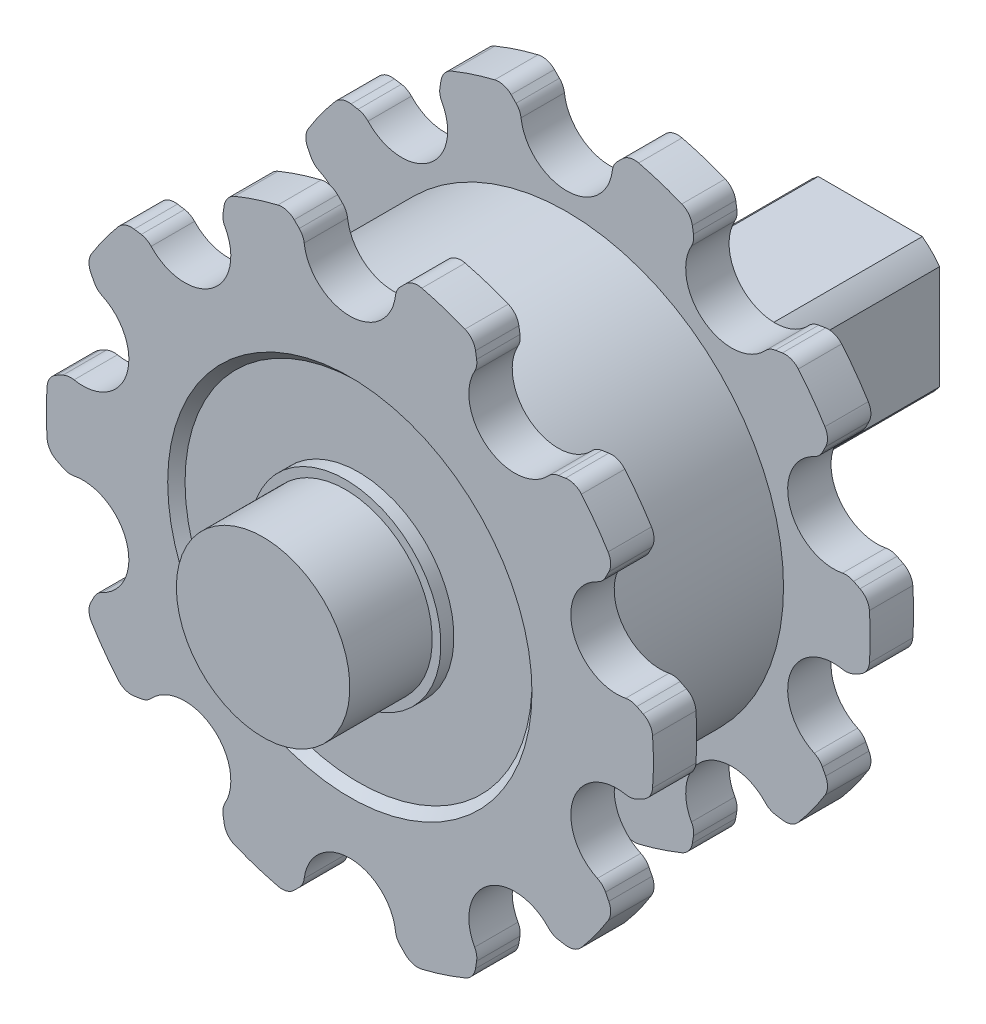
from build123d import *

# Parameters (mm, degrees)
TAGLIO_ESTRUSIONE1_DEPTH = 20
TAGLIO_ESTRUSIONE2_DEPTH = 43


with BuildPart() as part:
    # Schizzo1 → Rivoluzione1 (revolve)
    with BuildSketch(Plane(origin=(0, 0, 0), x_dir=(1, 0, 0), z_dir=(0, 1, 0)), mode=Mode.PRIVATE) as rivoluzione1_sk:
        Polygon((0, 0), (10, 0), (10, 9.5), (11, 9.5), (11, 11), (20, 11), (21, 10), (35, 10), (35, 15), (25, 15), (25, 35), (35, 35), (35, 40), (21, 40), (20, 39), (11, 39), (11, 40.5), (10, 40.5), (10, 70), (0, 70), align=None)
    revolve(rivoluzione1_sk.sketch.rotate(Axis((0, 0, -70), (0, 0, 1)), 180), axis=Axis((0, 0, -70), (0, 0, 1)))

    # Schizzo2 → Taglio-Estrusione1 (cut)
    with BuildSketch(Plane(origin=(0, 0, -70), x_dir=(-1, 0, 0), z_dir=(0, 0, -1))):
        with BuildLine():
            Line((-8, -6), (-8, 6))
            ThreePointArc((-8, 6), (-10, 0), (-8, -6))
        make_face()
        with BuildLine():
            Line((8, -6), (8, 6))
            ThreePointArc((8, 6), (10, 0), (8, -6))
        make_face()
        with BuildLine():
            Line((-6, 8), (6, 8))
            ThreePointArc((6, 8), (0, 10), (-6, 8))
        make_face()
        with BuildLine():
            Line((-6, -8), (6, -8))
            ThreePointArc((6, -8), (0, -10), (-6, -8))
        make_face()
    extrude(amount=-TAGLIO_ESTRUSIONE1_DEPTH, mode=Mode.SUBTRACT)

    # Schizzo3 → Taglio-Estrusione2 (cut)
    with BuildSketch(Plane(origin=(0, 0, -40), x_dir=(-1, 0, 0), z_dir=(0, 0, -1))):
        with BuildLine():
            Line((-5.832321184, 32.893001184), (-6.412064071, 33.472744071))
            ThreePointArc((-6.412064071, 33.472744071), (-7.287076109, 33.984474879), (-8.30059749, 34.001471752))
            ThreePointArc((-8.30059749, 34.001471752), (0, 35), (8.30059749, 34.001471752))
            ThreePointArc((8.30059749, 34.001471752), (7.287076109, 33.984474879), (6.412064071, 33.472744071))
            Line((6.412064071, 33.472744071), (5.832321184, 32.893001184))
            ThreePointArc((5.832321184, 32.893001184), (5.448477821, 32.354568013), (5.261182761, 31.720401972))
            ThreePointArc((5.261182761, 31.720401972), (0, 27.06068), (-5.261182761, 31.720401972))
            ThreePointArc((-5.261182761, 31.720401972), (-5.448477821, 32.354568013), (-5.832321184, 32.893001184))
        make_face()
        with BuildLine():
            Line((14.615574045, 30.039149333), (14.487316516, 30.8489355))
            ThreePointArc((14.487316516, 30.8489355), (14.080204729, 31.777253591), (13.270239219, 32.386737271))
            ThreePointArc((13.270239219, 32.386737271), (20.57248383, 28.315594803), (26.700888085, 22.628799691))
            ThreePointArc((26.700888085, 22.628799691), (25.870941552, 23.210781853), (24.862254122, 23.311102104))
            Line((24.862254122, 23.311102104), (24.052467954, 23.182844575))
            ThreePointArc((24.052467954, 23.182844575), (23.425449073, 22.972860457), (22.90117074, 22.569898627))
            ThreePointArc((22.90117074, 22.569898627), (15.905868621, 21.892549999), (14.388398212, 28.7547899))
            ThreePointArc((14.388398212, 28.7547899), (14.609626771, 29.377930279), (14.615574045, 30.039149333))
        make_face()
        with BuildLine():
            Line((29.480816754, 15.711363429), (29.8530346, 16.441882084))
            ThreePointArc((29.8530346, 16.441882084), (30.069325929, 17.4322015), (29.772295585, 18.401369937))
            ThreePointArc((29.772295585, 18.401369937), (33.28697807, 10.815594803), (34.902346961, 2.612695273))
            ThreePointArc((34.902346961, 2.612695273), (34.572986643, 3.571359064), (33.815908134, 4.245411448))
            Line((33.815908134, 4.245411448), (33.085389479, 4.617629295))
            ThreePointArc((33.085389479, 4.617629295), (32.454694981, 4.816301026), (31.793689879, 4.798461129))
            ThreePointArc((31.793689879, 4.798461129), (25.736236049, 8.362209999), (28.542100111, 14.805825426))
            ThreePointArc((28.542100111, 14.805825426), (29.0873505, 15.179921698), (29.480816754, 15.711363429))
        make_face()
        with BuildLine():
            Line((33.085389479, -4.617629295), (33.815908134, -4.245411448))
            ThreePointArc((33.815908134, -4.245411448), (34.572986643, -3.571359064), (34.902346961, -2.612695273))
            ThreePointArc((34.902346961, -2.612695273), (33.28697807, -10.815594803), (29.772295585, -18.401369937))
            ThreePointArc((29.772295585, -18.401369937), (30.069325929, -17.4322015), (29.8530346, -16.441882084))
            Line((29.8530346, -16.441882084), (29.480816754, -15.711363429))
            ThreePointArc((29.480816754, -15.711363429), (29.0873505, -15.179921698), (28.542100111, -14.805825426))
            ThreePointArc((28.542100111, -14.805825426), (25.736236049, -8.362209999), (31.793689879, -4.798461129))
            ThreePointArc((31.793689879, -4.798461129), (32.454694981, -4.816301026), (33.085389479, -4.617629295))
        make_face()
        with BuildLine():
            Line((24.052467954, -23.182844575), (24.862254122, -23.311102104))
            ThreePointArc((24.862254122, -23.311102104), (25.870941552, -23.210781853), (26.700888085, -22.628799691))
            ThreePointArc((26.700888085, -22.628799691), (20.57248383, -28.315594803), (13.270239219, -32.386737271))
            ThreePointArc((13.270239219, -32.386737271), (14.080204729, -31.777253591), (14.487316516, -30.8489355))
            Line((14.487316516, -30.8489355), (14.615574045, -30.039149333))
            ThreePointArc((14.615574045, -30.039149333), (14.609626771, -29.377930279), (14.388398212, -28.7547899))
            ThreePointArc((14.388398212, -28.7547899), (15.905868621, -21.892549999), (22.90117074, -22.569898627))
            ThreePointArc((22.90117074, -22.569898627), (23.425449073, -22.972860457), (24.052467954, -23.182844575))
        make_face()
        with BuildLine():
            Line((5.832321184, -32.893001184), (6.412064071, -33.472744071))
            ThreePointArc((6.412064071, -33.472744071), (7.287076109, -33.984474879), (8.30059749, -34.001471752))
            ThreePointArc((8.30059749, -34.001471752), (0, -35), (-8.30059749, -34.001471752))
            ThreePointArc((-8.30059749, -34.001471752), (-7.287076109, -33.984474879), (-6.412064071, -33.472744071))
            Line((-6.412064071, -33.472744071), (-5.832321184, -32.893001184))
            ThreePointArc((-5.832321184, -32.893001184), (-5.448477821, -32.354568013), (-5.261182761, -31.720401972))
            ThreePointArc((-5.261182761, -31.720401972), (0, -27.06068), (5.261182761, -31.720401972))
            ThreePointArc((5.261182761, -31.720401972), (5.448477821, -32.354568013), (5.832321184, -32.893001184))
        make_face()
        with BuildLine():
            Line((-14.615574045, -30.039149333), (-14.487316516, -30.8489355))
            ThreePointArc((-14.487316516, -30.8489355), (-14.080204729, -31.777253591), (-13.270239219, -32.386737271))
            ThreePointArc((-13.270239219, -32.386737271), (-20.57248383, -28.315594803), (-26.700888085, -22.628799691))
            ThreePointArc((-26.700888085, -22.628799691), (-25.870941552, -23.210781853), (-24.862254122, -23.311102104))
            Line((-24.862254122, -23.311102104), (-24.052467954, -23.182844575))
            ThreePointArc((-24.052467954, -23.182844575), (-23.425449073, -22.972860457), (-22.90117074, -22.569898627))
            ThreePointArc((-22.90117074, -22.569898627), (-15.905868621, -21.892549999), (-14.388398212, -28.7547899))
            ThreePointArc((-14.388398212, -28.7547899), (-14.609626771, -29.377930279), (-14.615574045, -30.039149333))
        make_face()
        with BuildLine():
            Line((-29.480816754, -15.711363429), (-29.8530346, -16.441882084))
            ThreePointArc((-29.8530346, -16.441882084), (-30.069325929, -17.4322015), (-29.772295585, -18.401369937))
            ThreePointArc((-29.772295585, -18.401369937), (-33.28697807, -10.815594803), (-34.902346961, -2.612695273))
            ThreePointArc((-34.902346961, -2.612695273), (-34.572986643, -3.571359064), (-33.815908134, -4.245411448))
            Line((-33.815908134, -4.245411448), (-33.085389479, -4.617629295))
            ThreePointArc((-33.085389479, -4.617629295), (-32.454694981, -4.816301026), (-31.793689879, -4.798461129))
            ThreePointArc((-31.793689879, -4.798461129), (-25.736236049, -8.362209999), (-28.542100111, -14.805825426))
            ThreePointArc((-28.542100111, -14.805825426), (-29.0873505, -15.179921698), (-29.480816754, -15.711363429))
        make_face()
        with BuildLine():
            Line((-33.085389479, 4.617629295), (-33.815908134, 4.245411448))
            ThreePointArc((-33.815908134, 4.245411448), (-34.572986643, 3.571359064), (-34.902346961, 2.612695273))
            ThreePointArc((-34.902346961, 2.612695273), (-33.28697807, 10.815594803), (-29.772295585, 18.401369937))
            ThreePointArc((-29.772295585, 18.401369937), (-30.069325929, 17.4322015), (-29.8530346, 16.441882084))
            Line((-29.8530346, 16.441882084), (-29.480816754, 15.711363429))
            ThreePointArc((-29.480816754, 15.711363429), (-29.0873505, 15.179921698), (-28.542100111, 14.805825426))
            ThreePointArc((-28.542100111, 14.805825426), (-25.736236049, 8.362209999), (-31.793689879, 4.798461129))
            ThreePointArc((-31.793689879, 4.798461129), (-32.454694981, 4.816301026), (-33.085389479, 4.617629295))
        make_face()
        with BuildLine():
            Line((-24.052467954, 23.182844575), (-24.862254122, 23.311102104))
            ThreePointArc((-24.862254122, 23.311102104), (-25.870941552, 23.210781853), (-26.700888085, 22.628799691))
            ThreePointArc((-26.700888085, 22.628799691), (-20.57248383, 28.315594803), (-13.270239219, 32.386737271))
            ThreePointArc((-13.270239219, 32.386737271), (-14.080204729, 31.777253591), (-14.487316516, 30.8489355))
            Line((-14.487316516, 30.8489355), (-14.615574045, 30.039149333))
            ThreePointArc((-14.615574045, 30.039149333), (-14.609626771, 29.377930279), (-14.388398212, 28.7547899))
            ThreePointArc((-14.388398212, 28.7547899), (-15.905868621, 21.892549999), (-22.90117074, 22.569898627))
            ThreePointArc((-22.90117074, 22.569898627), (-23.425449073, 22.972860457), (-24.052467954, 23.182844575))
        make_face()
    extrude(amount=-TAGLIO_ESTRUSIONE2_DEPTH, mode=Mode.SUBTRACT)


solid = part.part
